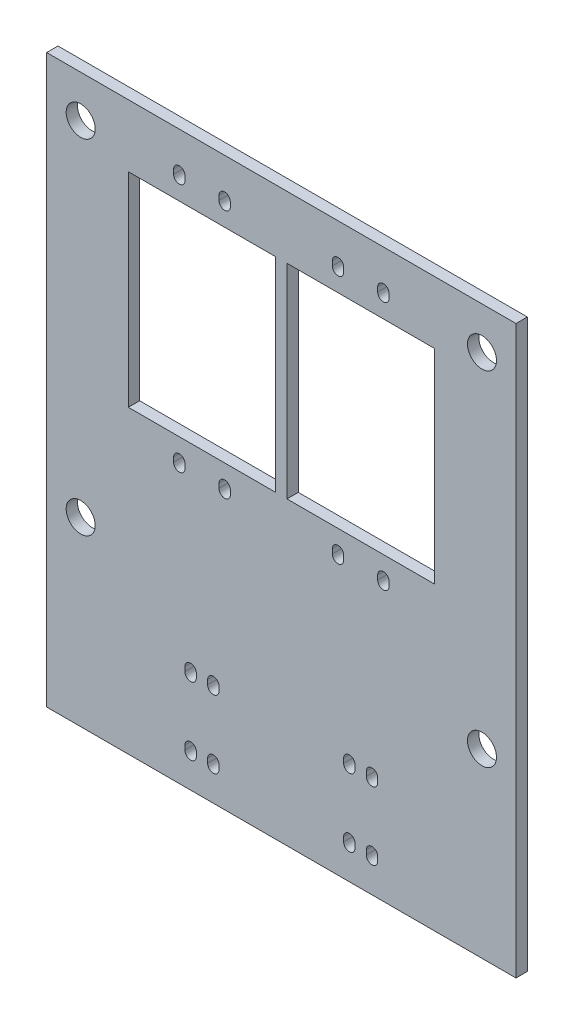
from build123d import *

# Parameters (mm, degrees)
SKETCH1_W           = 262.89
SKETCH1_H           = 317.5
BOSS_EXTRUDE1_DEPTH = 6.35
SKETCH2_W           = 82.55
SKETCH2_H           = 114.3
SKETCH2_R           = 8.128
CUT_EXTRUDE2_DEPTH  = 6.35
SKETCH2_5_R         = 8.128
CUT_EXTRUDE4_DEPTH  = 207.202989855


with BuildPart() as part:
    # Sketch1 → Boss-Extrude1 (new body)
    with BuildSketch(Plane.XY):
        Rectangle(SKETCH1_W, SKETCH1_H)
    extrude(amount=BOSS_EXTRUDE1_DEPTH)

    # Sketch2 → Cut-Extrude2 (cut)
    with BuildSketch(Plane.XY.offset(6.35)):
        with BuildLine():
            Line((47.625, -138.43), (47.625, -139.7))
            Line((47.625, -139.7), (47.625, -140.97))
            ThreePointArc((47.625, -140.97), (50.8, -144.145), (53.975, -140.97))
            Line((53.975, -140.97), (53.975, -138.43))
            ThreePointArc((53.975, -138.43), (50.8, -135.255), (47.625, -138.43))
        make_face()
        with BuildLine():
            Line((41.275, -140.97), (41.275, -139.7))
            Line((41.275, -139.7), (41.275, -138.43))
            ThreePointArc((41.275, -138.43), (38.1, -135.255), (34.925, -138.43))
            Line((34.925, -138.43), (34.925, -140.97))
            ThreePointArc((34.925, -140.97), (38.1, -144.145), (41.275, -140.97))
        make_face()
        with BuildLine():
            Line((-53.975, -100.33), (-53.975, -102.87))
            ThreePointArc((-53.975, -102.87), (-50.8, -106.045), (-47.625, -102.87))
            Line((-47.625, -102.87), (-47.625, -100.33))
            ThreePointArc((-47.625, -100.33), (-50.8, -97.155), (-53.975, -100.33))
        make_face()
        with BuildLine():
            ThreePointArc((-41.275, -102.87), (-38.1, -106.045), (-34.925, -102.87))
            Line((-34.925, -102.87), (-34.925, -100.33))
            ThreePointArc((-34.925, -100.33), (-38.1, -97.155), (-41.275, -100.33))
            Line((-41.275, -100.33), (-41.275, -102.87))
        make_face()
        with BuildLine():
            Line((-34.925, -140.97), (-34.925, -138.43))
            ThreePointArc((-34.925, -138.43), (-38.1, -135.255), (-41.275, -138.43))
            Line((-41.275, -138.43), (-41.275, -140.97))
            ThreePointArc((-41.275, -140.97), (-38.1, -144.145), (-34.925, -140.97))
        make_face()
        with BuildLine():
            ThreePointArc((-47.625, -138.43), (-50.8, -135.255), (-53.975, -138.43))
            Line((-53.975, -138.43), (-53.975, -140.97))
            ThreePointArc((-53.975, -140.97), (-50.8, -144.145), (-47.625, -140.97))
            Line((-47.625, -140.97), (-47.625, -138.43))
        make_face()
        with BuildLine():
            Line((34.925, -100.33), (34.925, -102.87))
            ThreePointArc((34.925, -102.87), (38.1, -106.045), (41.275, -102.87))
            Line((41.275, -102.87), (41.275, -100.33))
            ThreePointArc((41.275, -100.33), (38.1, -97.155), (34.925, -100.33))
        make_face()
        with BuildLine():
            ThreePointArc((47.625, -102.87), (50.8, -106.045), (53.975, -102.87))
            Line((53.975, -102.87), (53.975, -100.33))
            ThreePointArc((53.975, -100.33), (50.8, -97.155), (47.625, -100.33))
            Line((47.625, -100.33), (47.625, -102.87))
        make_face()
        with Locations((-44.45, 66.675)):
            Rectangle(SKETCH2_W, SKETCH2_H)
        with BuildLine():
            Line((-28.575, 135.255), (-28.575, 137.795))
            ThreePointArc((-28.575, 137.795), (-31.75, 140.97), (-34.925, 137.795))
            Line((-34.925, 137.795), (-34.925, 135.255))
            ThreePointArc((-34.925, 135.255), (-31.75, 132.08), (-28.575, 135.255))
        make_face()
        with BuildLine():
            ThreePointArc((-53.975, 137.795), (-57.15, 140.97), (-60.325, 137.795))
            Line((-60.325, 137.795), (-60.325, 135.255))
            ThreePointArc((-60.325, 135.255), (-57.15, 132.08), (-53.975, 135.255))
            Line((-53.975, 135.255), (-53.975, 137.795))
        make_face()
        with BuildLine():
            ThreePointArc((-34.925, -4.445), (-31.75, -7.62), (-28.575, -4.445))
            Line((-28.575, -4.445), (-28.575, -1.905))
            ThreePointArc((-28.575, -1.905), (-31.75, 1.27), (-34.925, -1.905))
            Line((-34.925, -1.905), (-34.925, -4.445))
        make_face()
        with BuildLine():
            Line((-60.325, -1.905), (-60.325, -4.445))
            ThreePointArc((-60.325, -4.445), (-57.15, -7.62), (-53.975, -4.445))
            Line((-53.975, -4.445), (-53.975, -1.905))
            ThreePointArc((-53.975, -1.905), (-57.15, 1.27), (-60.325, -1.905))
        make_face()
        with BuildLine():
            Line((28.575, -1.905), (28.575, -4.445))
            ThreePointArc((28.575, -4.445), (31.75, -7.62), (34.925, -4.445))
            Line((34.925, -4.445), (34.925, -1.905))
            ThreePointArc((34.925, -1.905), (31.75, 1.27), (28.575, -1.905))
        make_face()
        with BuildLine():
            ThreePointArc((53.975, -4.445), (57.15, -7.62), (60.325, -4.445))
            Line((60.325, -4.445), (60.325, -1.905))
            ThreePointArc((60.325, -1.905), (57.15, 1.27), (53.975, -1.905))
            Line((53.975, -1.905), (53.975, -4.445))
        make_face()
        with Locations((44.45, 66.675)):
            Rectangle(SKETCH2_W, SKETCH2_H)
        with BuildLine():
            ThreePointArc((34.925, 137.795), (31.75, 140.97), (28.575, 137.795))
            Line((28.575, 137.795), (28.575, 135.255))
            ThreePointArc((28.575, 135.255), (31.75, 132.08), (34.925, 135.255))
            Line((34.925, 135.255), (34.925, 137.795))
        make_face()
        with BuildLine():
            Line((60.325, 135.255), (60.325, 137.795))
            ThreePointArc((60.325, 137.795), (57.15, 140.97), (53.975, 137.795))
            Line((53.975, 137.795), (53.975, 135.255))
            ThreePointArc((53.975, 135.255), (57.15, 132.08), (60.325, 135.255))
        make_face()
        with Locations((-112.395, -57.15)):
            Circle(SKETCH2_R)
        with Locations((112.395, -57.15)):
            Circle(SKETCH2_R)
    extrude(amount=-CUT_EXTRUDE2_DEPTH, mode=Mode.SUBTRACT)

    # Sketch2<5> → Cut-Extrude4 (cut, through all)
    with BuildSketch(Plane.XY.offset(6.35)):
        with Locations((-112.395, 135.255)):
            Circle(SKETCH2_5_R)
        with Locations((112.395, 135.255)):
            Circle(SKETCH2_5_R)
    extrude(amount=-CUT_EXTRUDE4_DEPTH, mode=Mode.SUBTRACT)


solid = part.part
